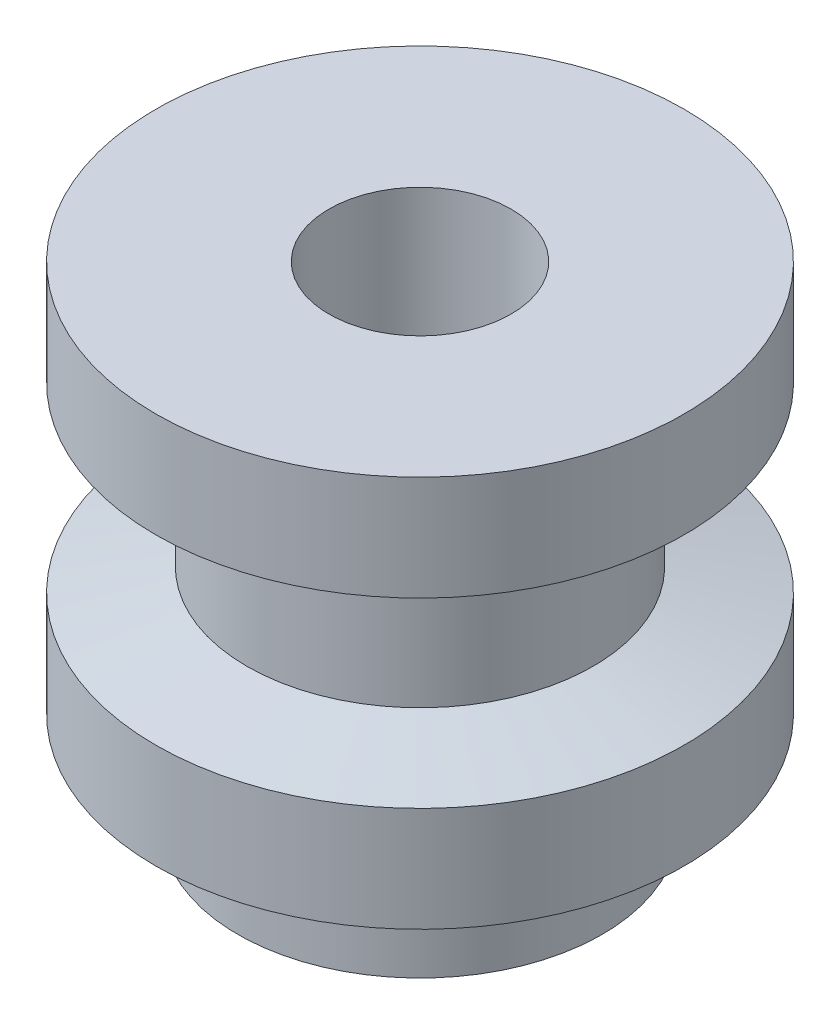
from build123d import *


with BuildPart() as part:
    # Sketch1 → Revolve1 (revolve)
    with BuildSketch(Plane(origin=(0, 0, 0), x_dir=(0, 0, -1), z_dir=(1, 0, 0)), mode=Mode.PRIVATE) as revolve1_sk:
        Polygon((-1, 0), (-1, 5.4), (-2.9, 5.4), (-2.9, 4.25), (-1.9, 4), (-1.9, 2.5), (-2.9, 2.25), (-2.9, 1.1), (-2, 1.1), (-2, 0), align=None)
    revolve(revolve1_sk.sketch.rotate(Axis((0, 0, 0), (0, 1, 0)), 180), axis=Axis((0, 0, 0), (0, 1, 0)))


solid = part.part
